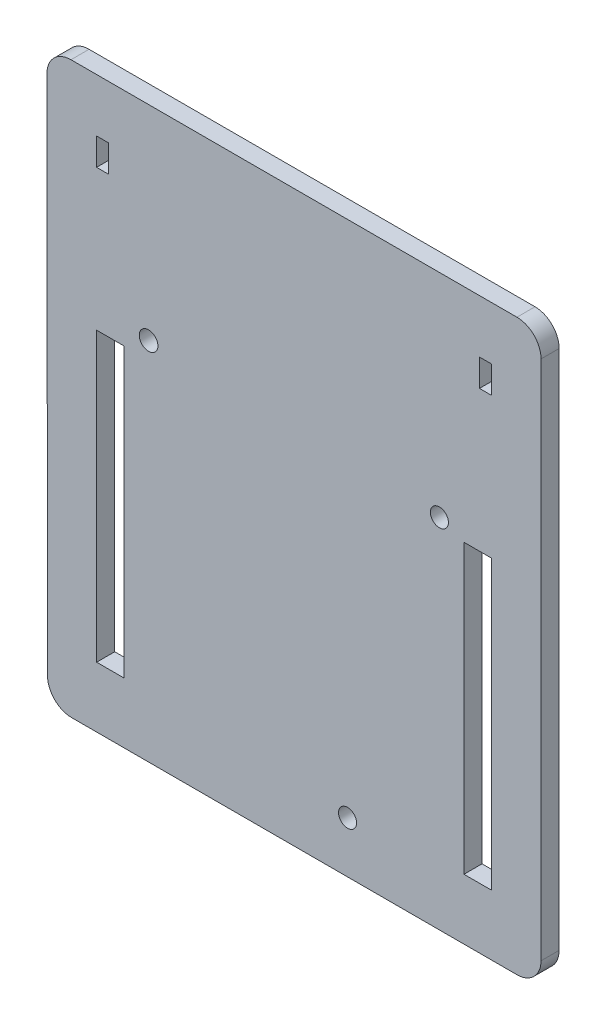
from build123d import *

# Parameters (mm, degrees)
ESQUISSE1_R        = 1.5
ESQUISSE1_R_2      = 1.548892625
ESQUISSE1_W        = 4.54
ESQUISSE1_H        = 47.72
ESQUISSE1_W_2      = 1.965612554
ESQUISSE1_H_2      = 4.508607734
BOSS_EXTRU_1_DEPTH = 3
CONG_1_R           = 4


with BuildPart() as part:
    # Esquisse1 → Boss.-Extru.1 (new body)
    with BuildSketch(Plane.XY):
        Polygon((-41.006346513, 88.5), (41.006346513, 88.5), (41.006346513, -6), (-40.884024197, -6), align=None)
        with Locations((8.896346513, 2.5)):
            Circle(ESQUISSE1_R, mode=Mode.SUBTRACT)
        with Locations((-24.123653487, 54.57)):
            Circle(ESQUISSE1_R_2, mode=Mode.SUBTRACT)
        with Locations((24.136346513, 53.3)):
            Circle(ESQUISSE1_R, mode=Mode.SUBTRACT)
        with Locations((-30.473653487, 27.9)):
            Rectangle(ESQUISSE1_W, ESQUISSE1_H, mode=Mode.SUBTRACT)
        with Locations((30.486346513, 27.9)):
            Rectangle(ESQUISSE1_W, ESQUISSE1_H, mode=Mode.SUBTRACT)
        with Locations((31.773540236, 77.411308687)):
            Rectangle(ESQUISSE1_W_2, ESQUISSE1_H_2, mode=Mode.SUBTRACT)
        with Locations((-31.773540236, 77.411308687)):
            Rectangle(ESQUISSE1_W_2, ESQUISSE1_H_2, mode=Mode.SUBTRACT)
    extrude(amount=BOSS_EXTRU_1_DEPTH)

    # Congé1
    cong_1_edges = [part.edges().sort_by_distance(p)[0] for p in [
        (-41.006346513, 88.5, 1.5),
        (41.006346513, 88.5, 1.5),
        (41.006346513, -6, 1.5),
        (-40.884024197, -6, 1.5),
    ]]
    fillet(cong_1_edges, radius=CONG_1_R)


solid = part.part
